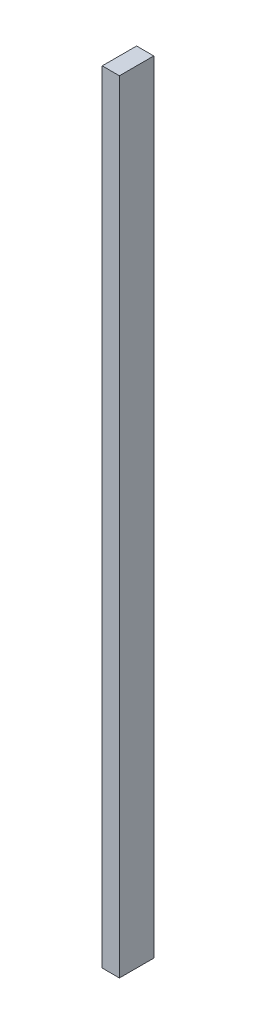
from build123d import *

# Parameters (mm, degrees)
SKETCH1_W           = 25.4
SKETCH1_H           = 50.8
BOSS_EXTRUDE1_DEPTH = 1155.192


with BuildPart() as part:
    # Sketch1 → Boss-Extrude1 (new body)
    with BuildSketch(Plane(origin=(0, 0, 0), x_dir=(1, 0, 0), z_dir=(0, 1, 0))):
        Rectangle(SKETCH1_W, SKETCH1_H)
    extrude(amount=BOSS_EXTRUDE1_DEPTH)


solid = part.part
